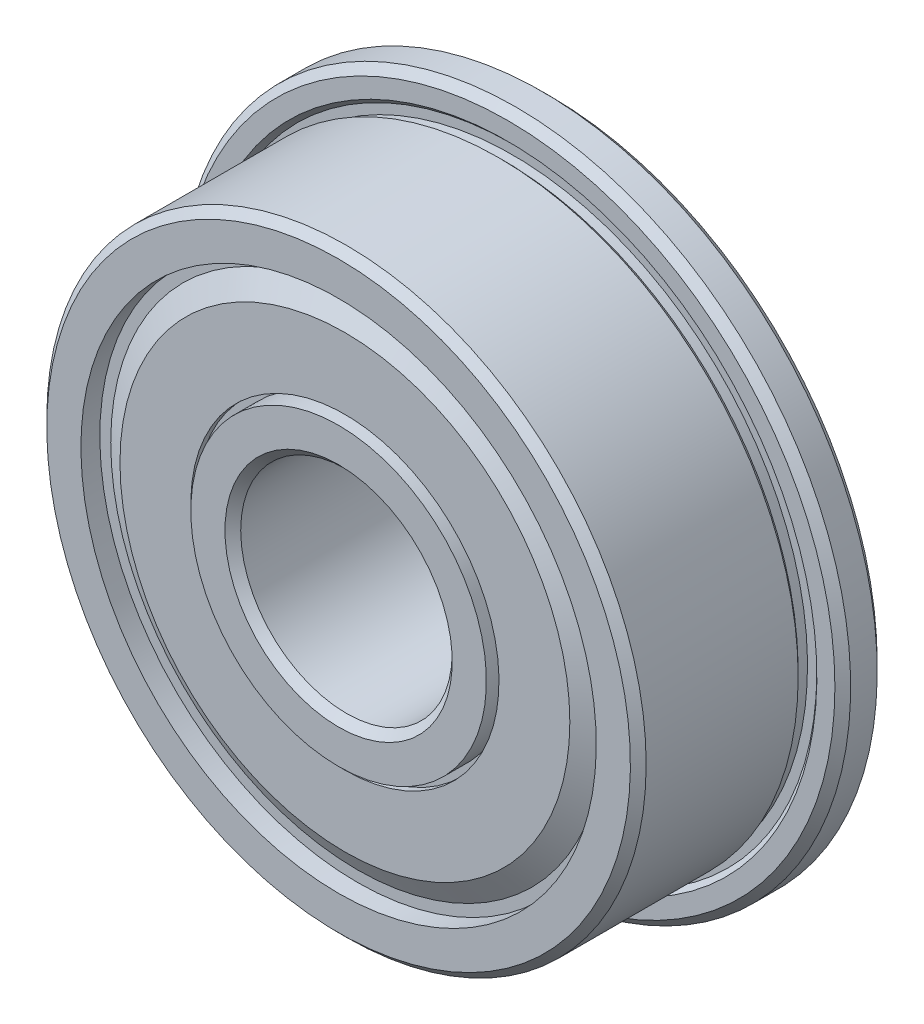
from build123d import *

# Parameters (mm, degrees)
FILLET1_SIZE      = 0.2234375
FILLET2_SIZE      = 0.2234375
CIRPATTERN3_COUNT = 6
SKETCH8_W         = 0.715
SKETCH8_H         = 0.595833333


with BuildPart() as part:
    # Sketch2 → Revolve1 (revolve)
    with BuildSketch(Plane(origin=(0, 0, 0), x_dir=(0, 0, -1), z_dir=(1, 0, 0)), mode=Mode.PRIVATE) as revolve1_sk:
        with BuildLine():
            Line((3, 9.5), (1.8, 9.5))
            Line((1.8, 9.5), (1.8, 8.765165043))
            Line((1.8, 8.765165043), (1.932582521, 8.632582521))
            Line((1.932582521, 8.632582521), (1.932582521, 8.367417479))
            Line((1.932582521, 8.367417479), (1.667417479, 8.367417479))
            Line((1.667417479, 8.367417479), (1.534834957, 8.5))
            Line((1.534834957, 8.5), (-3, 8.5))
            Line((-3, 8.5), (-3, 6.7125))
            Line((-3, 6.7125), (-1.461538145, 6.7125))
            ThreePointArc((-1.461538145, 6.7125), (0, 7.5), (1.461538145, 6.7125))
            Line((1.461538145, 6.7125), (3, 6.7125))
            Line((3, 6.7125), (3, 9.5))
        make_face()
        with BuildLine():
            Line((3, 3), (-3, 3))
            Line((-3, 3), (-3, 4.7875))
            Line((-3, 4.7875), (-1.461538145, 4.7875))
            ThreePointArc((-1.461538145, 4.7875), (0, 4), (1.461538145, 4.7875))
            Line((1.461538145, 4.7875), (3, 4.7875))
            Line((3, 4.7875), (3, 3))
        make_face()
    revolve(revolve1_sk.sketch.rotate(Axis((0, 0, 0), (0, 0, -1)), 180), axis=Axis((0, 0, 0), (0, 0, -1)))

    # Fillet1
    fillet1_edges = [part.edges().sort_by_distance(p)[0] for p in [
        (0, 8.5, 3),
        (0, 9.5, -3),
        (0, 9.5, -1.8),
    ]]
    chamfer(fillet1_edges, length=FILLET1_SIZE)

    # Fillet2
    fillet2_edges = [part.edges().sort_by_distance(p)[0] for p in [
        (0, 3, -3),
        (0, 3, 3),
    ]]
    chamfer(fillet2_edges, length=FILLET2_SIZE)

    # Sketch8 → Cut-Revolve1 (revolve, cut)
    with BuildSketch(Plane(origin=(0, 0, 0), x_dir=(0, 0, -1), z_dir=(1, 0, 0)), mode=Mode.PRIVATE) as cut_revolve1_sk:
        with Locations((-2.6425, 7.010416667)):
            Rectangle(SKETCH8_W, SKETCH8_H)
        with Locations((2.6425, 7.010416667)):
            Rectangle(SKETCH8_W, SKETCH8_H)
        with Locations((2.6425, 4.489583334)):
            Rectangle(SKETCH8_W, SKETCH8_H)
        with Locations((-2.6425, 4.489583334)):
            Rectangle(SKETCH8_W, SKETCH8_H)
    revolve(cut_revolve1_sk.sketch.rotate(Axis((0, 0, 0), (0, 0, -1)), 180), axis=Axis((0, 0, 0), (0, 0, -1)), mode=Mode.SUBTRACT)


with BuildPart() as body_2:
    # Sketch7 → Revolve3 (revolve)
    with BuildSketch(Plane.XY):
        with BuildLine():
            Line((0, 7.5), (0, 4))
            ThreePointArc((0, 4), (-1.75, 5.75), (0, 7.5))
        make_face()
    revolve(axis=Axis((0, 7.5, 0), (0, -1, 0)))


with BuildPart() as cirpattern3_1:
    # CirPattern3: pattern copy
    add(body_2.part.rotate(Axis((0, 0, 0), (0, 0, 1)), 1 * 360 / CIRPATTERN3_COUNT))


with BuildPart() as cirpattern3_2:
    # CirPattern3: pattern copy
    add(body_2.part.rotate(Axis((0, 0, 0), (0, 0, 1)), 2 * 360 / CIRPATTERN3_COUNT))


with BuildPart() as cirpattern3_3:
    # CirPattern3: pattern copy
    add(body_2.part.rotate(Axis((0, 0, 0), (0, 0, 1)), 3 * 360 / CIRPATTERN3_COUNT))


with BuildPart() as cirpattern3_4:
    # CirPattern3: pattern copy
    add(body_2.part.rotate(Axis((0, 0, 0), (0, 0, 1)), 4 * 360 / CIRPATTERN3_COUNT))


with BuildPart() as cirpattern3_5:
    # CirPattern3: pattern copy
    add(body_2.part.rotate(Axis((0, 0, 0), (0, 0, 1)), 5 * 360 / CIRPATTERN3_COUNT))


with BuildPart() as body_8:
    # Sketch9 → Revolve4 (revolve)
    with BuildSketch(Plane(origin=(0, 0, 0), x_dir=(0, 0, -1), z_dir=(1, 0, 0)), mode=Mode.PRIVATE) as revolve4_sk:
        Polygon((-2.285, 7.308333333), (-2.285, 6.951190476), (-2.6425, 6.331982312), (-2.6425, 4.370416667), (-2.82125, 4.370416667), (-2.82125, 6.379878231), (-2.46375, 6.999086394), (-2.46375, 7.308333333), align=None)
        Polygon((2.285, 7.308333333), (2.285, 6.951190476), (2.6425, 6.331982312), (2.6425, 4.370416667), (2.82125, 4.370416667), (2.82125, 6.379878231), (2.46375, 6.999086394), (2.46375, 7.308333333), align=None)
    revolve(revolve4_sk.sketch.rotate(Axis((0, 0, 0), (0, 0, -1)), 180), axis=Axis((0, 0, 0), (0, 0, -1)))


solid = Compound([part.part, body_2.part, cirpattern3_1.part, cirpattern3_2.part, cirpattern3_3.part, cirpattern3_4.part, cirpattern3_5.part, body_8.part])
